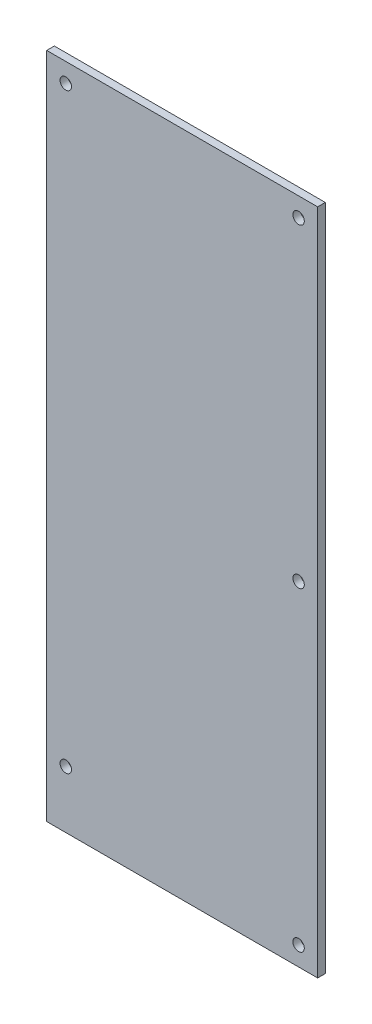
from build123d import *

# Parameters (mm, degrees)
SKICA1_W                = 142
SKICA1_H                = 350
SKICA1_R                = 3
P_IDAT_VYSUNUT_M1_DEPTH = 4


with BuildPart() as part:
    # Skica1 → Přidat vysunutím1 (new body)
    with BuildSketch(Plane.XY):
        Rectangle(SKICA1_W, SKICA1_H)
        with Locations((61, 165)):
            Circle(SKICA1_R, mode=Mode.SUBTRACT)
        with Locations((61, -165)):
            Circle(SKICA1_R, mode=Mode.SUBTRACT)
        with Locations((61, 0)):
            Circle(SKICA1_R, mode=Mode.SUBTRACT)
        with Locations((-61, -145)):
            Circle(SKICA1_R, mode=Mode.SUBTRACT)
        with Locations((-61, 165)):
            Circle(SKICA1_R, mode=Mode.SUBTRACT)
    extrude(amount=P_IDAT_VYSUNUT_M1_DEPTH)


solid = part.part
